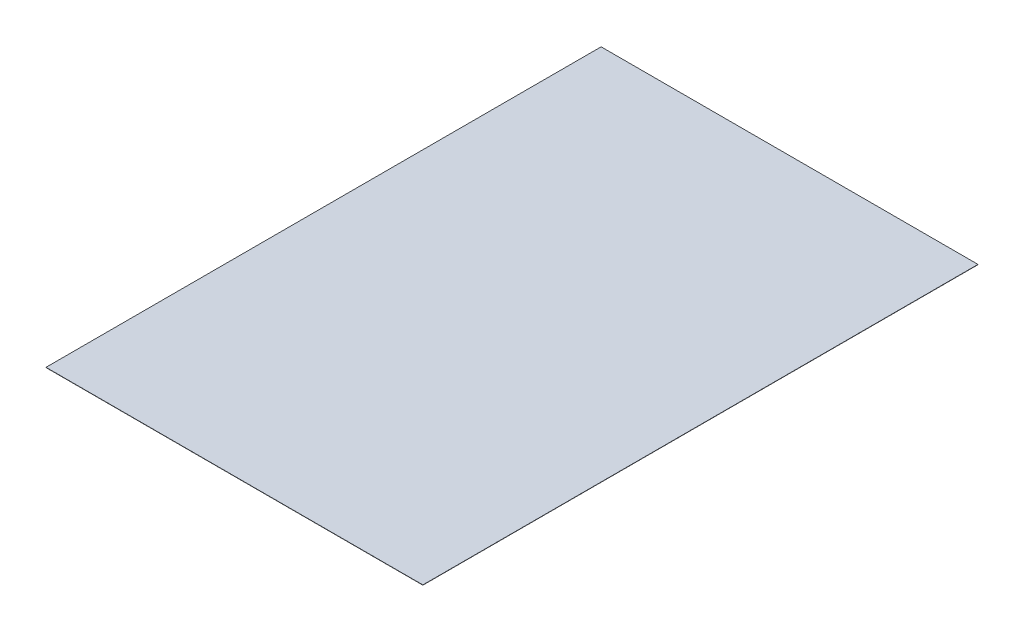
from build123d import *

# Parameters (mm, degrees)
SKETCH1_W           = 7400
SKETCH1_H           = 10900
BOSS_EXTRUDE1_DEPTH = 5


with BuildPart() as part:
    # Sketch1 → Boss-Extrude1 (new body)
    with BuildSketch(Plane(origin=(0, 0, 0), x_dir=(1, 0, 0), z_dir=(0, 1, 0))):
        Rectangle(SKETCH1_W, SKETCH1_H)
    extrude(amount=BOSS_EXTRUDE1_DEPTH)


solid = part.part
